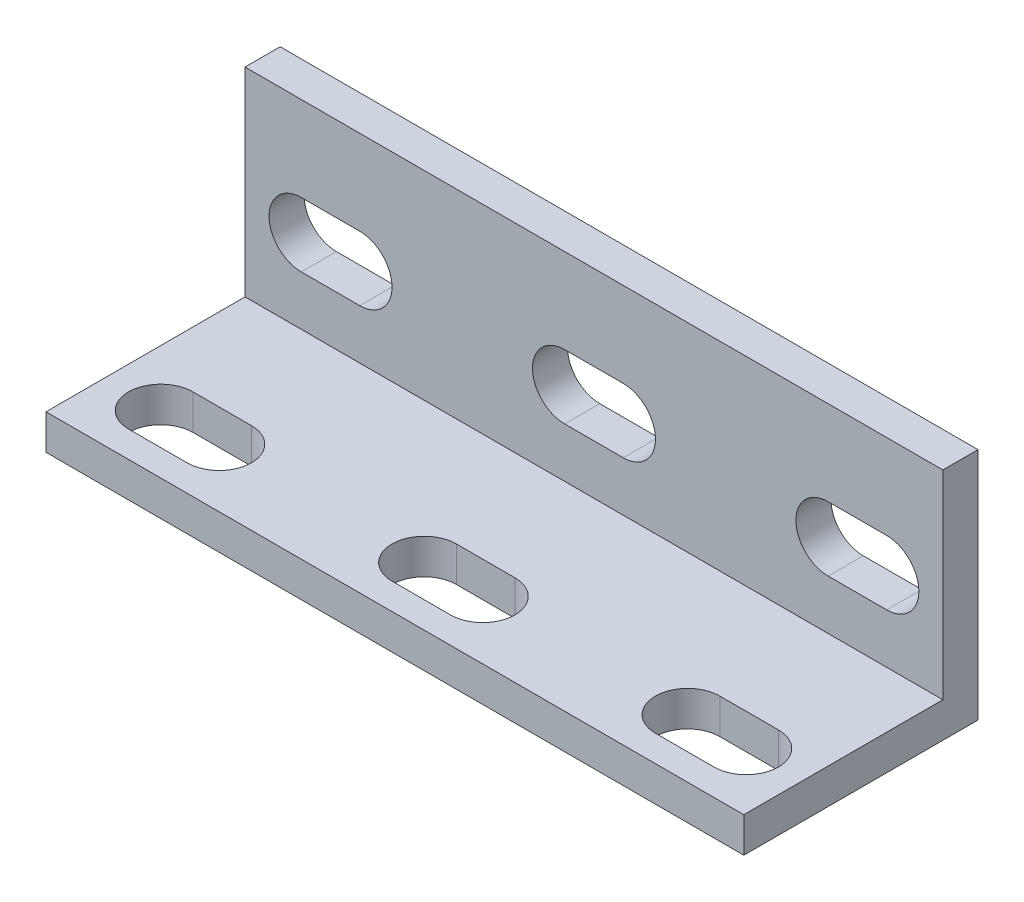
from build123d import *

# Parameters (mm, degrees)
BOSS_EXTRUDE1_DEPTH = 29.8
CUT_EXTRUDE1_DEPTH  = 3
CUT_EXTRUDE2_DEPTH  = 3


with BuildPart() as part:
    # Sketch2 → Boss-Extrude1 (new, symmetric)
    with BuildSketch(Plane(origin=(0, 0, 0), x_dir=(0, 0, -1), z_dir=(1, 0, 0))):
        Polygon((0, 0), (0, 20), (-3, 20), (-3, 3), (-20, 3), (-20, 0), align=None)
    extrude(amount=BOSS_EXTRUDE1_DEPTH, both=True)

    # Sketch3 → Cut-Extrude1 (cut)
    with BuildSketch(Plane(origin=(0, 3, 0), x_dir=(1, 0, 0), z_dir=(0, 1, 0))):
        with BuildLine():
            Line((-2.5, -12.25), (2.5, -12.25))
            ThreePointArc((2.5, -12.25), (5.25, -15), (2.5, -17.75))
            Line((2.5, -17.75), (-2.5, -17.75))
            ThreePointArc((-2.5, -17.75), (-5.25, -15), (-2.5, -12.25))
        make_face()
        with BuildLine():
            Line((20, -12.25), (25, -12.25))
            ThreePointArc((25, -12.25), (27.75, -15), (25, -17.75))
            Line((25, -17.75), (20, -17.75))
            ThreePointArc((20, -17.75), (17.25, -15), (20, -12.25))
        make_face()
        with BuildLine():
            Line((-25, -12.25), (-20, -12.25))
            ThreePointArc((-20, -12.25), (-17.25, -15), (-20, -17.75))
            Line((-20, -17.75), (-25, -17.75))
            ThreePointArc((-25, -17.75), (-27.75, -15), (-25, -12.25))
        make_face()
    extrude(amount=-CUT_EXTRUDE1_DEPTH, mode=Mode.SUBTRACT)

    # Sketch5 → Cut-Extrude2 (cut)
    with BuildSketch(Plane.XY.offset(3)):
        with BuildLine():
            Line((2.5, 7.25), (-2.5, 7.25))
            ThreePointArc((-2.5, 7.25), (-5.25, 10), (-2.5, 12.75))
            Line((-2.5, 12.75), (2.5, 12.75))
            ThreePointArc((2.5, 12.75), (5.25, 10), (2.5, 7.25))
        make_face()
        with BuildLine():
            Line((20, 12.75), (25, 12.75))
            ThreePointArc((25, 12.75), (27.75, 10), (25, 7.25))
            Line((25, 7.25), (20, 7.25))
            ThreePointArc((20, 7.25), (17.25, 10), (20, 12.75))
        make_face()
        with BuildLine():
            Line((-20, 7.25), (-25, 7.25))
            ThreePointArc((-25, 7.25), (-27.75, 10), (-25, 12.75))
            Line((-25, 12.75), (-20, 12.75))
            ThreePointArc((-20, 12.75), (-17.25, 10), (-20, 7.25))
        make_face()
    extrude(amount=-CUT_EXTRUDE2_DEPTH, mode=Mode.SUBTRACT)


solid = part.part
